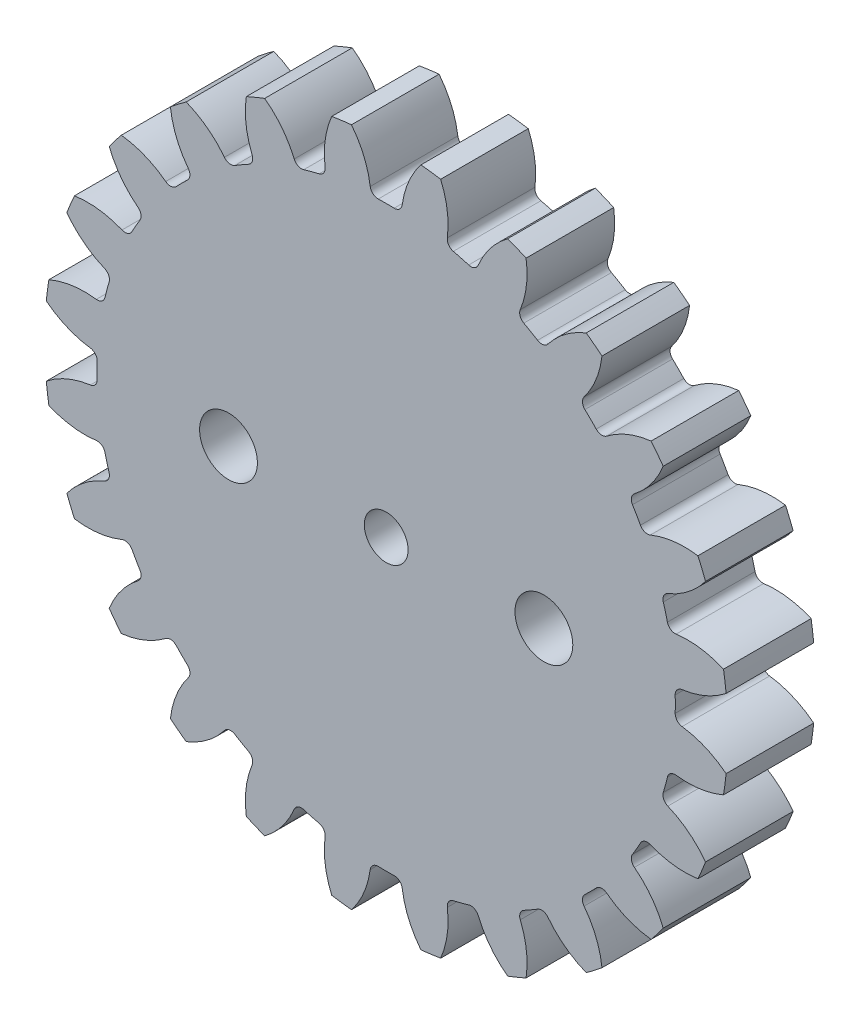
from build123d import *

# Parameters (mm, degrees)
SKETCH1_R                      = 19.5
BOSS_EXTRUDE1_DEPTH            = 2.5
CUT_EXTRUDE1_DEPTH             = 28.690250992
FILLET2_R                      = 0.45
CIRPATTERN1_COUNT              = 24
FILLET2_OF_CIRPATTERN1_R       = 0.45
THROUGH_CENTER_HOLE_DEPTH      = 28.548081241
THROUGH_CENTER_HOLE_DEPTH_BACK = 28.548081241
SKETCH4_R                      = 1.25
TO_KNUCKLE_MOUNT_DEPTH         = 28.548081241
TO_KNUCKLE_MOUNT_DEPTH_BACK    = 28.548081241
SKETCH5_R                      = 1.65


with BuildPart() as part:
    # Sketch1 → Boss-Extrude1 (new, symmetric)
    with BuildSketch(Plane.XY):
        Circle(SKETCH1_R)
    extrude(amount=BOSS_EXTRUDE1_DEPTH, both=True)

    # Sketch3 → Cut-Extrude1 (cut, symmetric)
    with BuildSketch(Plane.XY):
        with BuildLine():
            ThreePointArc((-0.87467636, 16.476800092), (0, 16.5), (0.87467636, 16.476800092))
            ThreePointArc((0.87467636, 16.476800092), (1.200531021, 18.024135297), (1.981568596, 19.399056315))
            ThreePointArc((1.981568596, 19.399056315), (0, 19.5), (-1.981568596, 19.399056315))
            ThreePointArc((-1.981568596, 19.399056315), (-1.200531021, 18.024135297), (-0.87467636, 16.476800092))
        make_face()
    cut_extrude1 = extrude(amount=CUT_EXTRUDE1_DEPTH, both=True, mode=Mode.SUBTRACT)

    # Fillet2
    fillet2_edges = [part.edges().sort_by_distance(p)[0] for p in [
        (0.87467636, 16.476800092, 0),
        (-0.87467636, 16.476800092, 0),
    ]]
    fillet(fillet2_edges, radius=FILLET2_R)

    # CirPattern1: Cut-Extrude1 ×24 about axis
    cirpattern1_axis = Axis((0, 0, 0), (0, 0, 1))
    for i in range(1, CIRPATTERN1_COUNT):
        add(cut_extrude1.rotate(cirpattern1_axis, i * 360 / CIRPATTERN1_COUNT), mode=Mode.SUBTRACT)

    # Fillet2 of CirPattern1
    fillet2_of_cirpattern1_edges = [part.edges().sort_by_distance(p)[0] for p in [
        (-3.41963718, 16.141749644, 0),
        (-5.109382152, 15.688983843, 0),
        (-7.480908098, 14.706665633, 0),
        (-8.995891994, 13.831989272, 0),
        (-11.032367491, 12.269346663, 0),
        (-12.269346663, 11.032367491, 0),
        (-13.831989272, 8.995891994, 0),
        (-14.706665633, 7.480908098, 0),
        (-15.688983843, 5.109382152, 0),
        (-16.141749644, 3.41963718, 0),
        (-16.476800092, 0.87467636, 0),
        (-16.476800092, -0.87467636, 0),
        (-16.141749644, -3.41963718, 0),
        (-15.688983843, -5.109382152, 0),
        (-14.706665633, -7.480908098, 0),
        (-13.831989272, -8.995891994, 0),
        (-12.269346663, -11.032367491, 0),
        (-11.032367491, -12.269346663, 0),
        (-8.995891994, -13.831989272, 0),
        (-7.480908098, -14.706665633, 0),
        (-5.109382152, -15.688983843, 0),
        (-3.41963718, -16.141749644, 0),
        (-0.87467636, -16.476800092, 0),
        (0.87467636, -16.476800092, 0),
        (3.41963718, -16.141749644, 0),
        (5.109382152, -15.688983843, 0),
        (7.480908098, -14.706665633, 0),
        (8.995891994, -13.831989272, 0),
        (11.032367491, -12.269346663, 0),
        (12.269346663, -11.032367491, 0),
        (13.831989272, -8.995891994, 0),
        (14.706665633, -7.480908098, 0),
        (15.688983843, -5.109382152, 0),
        (16.141749644, -3.41963718, 0),
        (16.476800092, -0.87467636, 0),
        (16.476800092, 0.87467636, 0),
        (16.141749644, 3.41963718, 0),
        (15.688983843, 5.109382152, 0),
        (14.706665633, 7.480908098, 0),
        (13.831989272, 8.995891994, 0),
        (12.269346663, 11.032367491, 0),
        (11.032367491, 12.269346663, 0),
        (8.995891994, 13.831989272, 0),
        (7.480908098, 14.706665633, 0),
        (5.109382152, 15.688983843, 0),
        (3.41963718, 16.141749644, 0),
    ]]
    fillet(fillet2_of_cirpattern1_edges, radius=FILLET2_OF_CIRPATTERN1_R)

    # Sketch4 → Through_Center_Hole (cut, two sides: drawn at the far end of the back side and taken through both)
    with BuildSketch(Plane.XY.offset(-THROUGH_CENTER_HOLE_DEPTH_BACK)):
        Circle(SKETCH4_R)
    extrude(amount=THROUGH_CENTER_HOLE_DEPTH + THROUGH_CENTER_HOLE_DEPTH_BACK, mode=Mode.SUBTRACT)

    # Sketch5 → To_Knuckle_Mount (cut, two sides: drawn at the far end of the back side and taken through both)
    with BuildSketch(Plane.XY.offset(-TO_KNUCKLE_MOUNT_DEPTH_BACK)):
        with Locations((9, 0)):
            Circle(SKETCH5_R)
        with Locations((-9, 0)):
            Circle(SKETCH5_R)
    extrude(amount=TO_KNUCKLE_MOUNT_DEPTH + TO_KNUCKLE_MOUNT_DEPTH_BACK, mode=Mode.SUBTRACT)


solid = part.part
